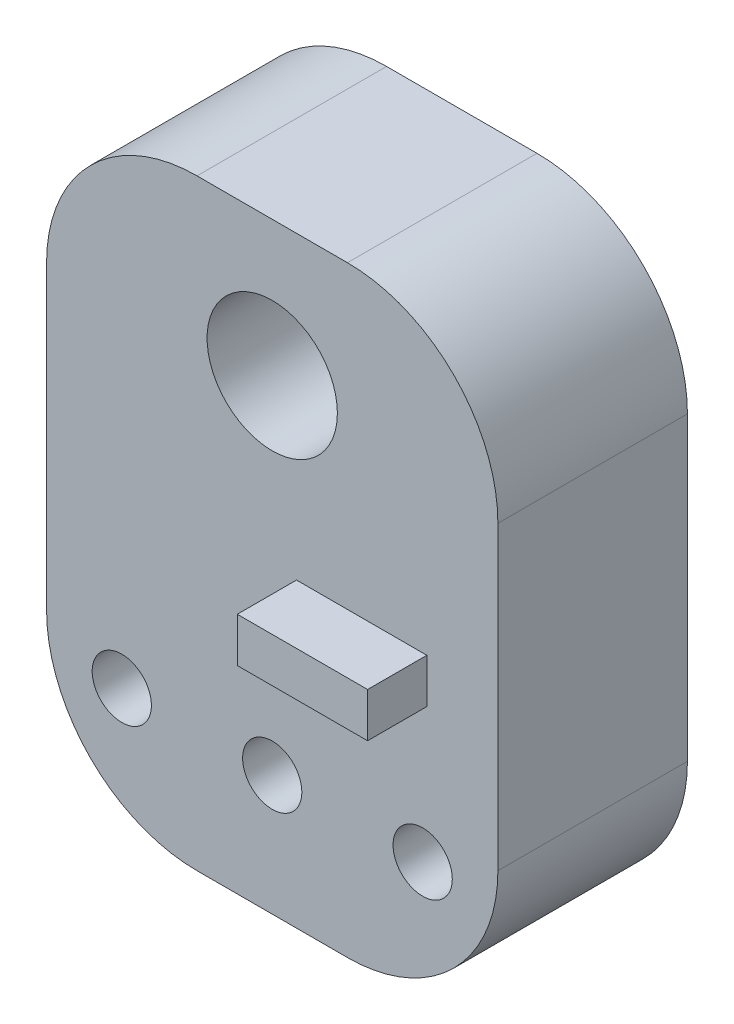
from build123d import *

# Parameters (mm, degrees)
ESQUISSE1_R        = 0.5
ESQUISSE1_R_2      = 1.1
BOSS_EXTRU_1_DEPTH = 3.2
ESQUISSE2_W        = 2.2
ESQUISSE2_H        = 0.75
BOSS_EXTRU_2_DEPTH = 1


with BuildPart() as part:
    # Esquisse1 → Boss.-Extru.1 (new body)
    with BuildSketch(Plane.XY):
        with BuildLine():
            Line((20.068312942, 10.16), (22.608312942, 10.16))
            ThreePointArc((22.608312942, 10.16), (24.404364166, 9.416051224), (25.148312942, 7.62))
            Line((25.148312942, 7.62), (25.148312942, 2.54))
            ThreePointArc((25.148312942, 2.54), (24.404364166, 0.743948776), (22.608312942, 0))
            Line((22.608312942, 0), (20.068312942, 0))
            ThreePointArc((20.068312942, 0), (18.272261718, 0.743948776), (17.528312942, 2.54))
            Line((17.528312942, 2.54), (17.528312942, 7.62))
            ThreePointArc((17.528312942, 7.62), (18.272261718, 9.416051224), (20.068312942, 10.16))
        make_face()
        with Locations((18.798312942, 2.032)):
            Circle(ESQUISSE1_R, mode=Mode.SUBTRACT)
        with Locations((21.338312942, 2.032)):
            Circle(ESQUISSE1_R, mode=Mode.SUBTRACT)
        with Locations((23.878312942, 2.032)):
            Circle(ESQUISSE1_R, mode=Mode.SUBTRACT)
        with Locations((21.338312942, 7.874)):
            Circle(ESQUISSE1_R_2, mode=Mode.SUBTRACT)
    extrude(amount=BOSS_EXTRU_1_DEPTH)

    # Esquisse2 → Boss.-Extru.2 (add)
    with BuildSketch(Plane.XY.offset(3.2)):
        with Locations((22.848312942, 4.715)):
            Rectangle(ESQUISSE2_W, ESQUISSE2_H)
    extrude(amount=BOSS_EXTRU_2_DEPTH)


solid = part.part
